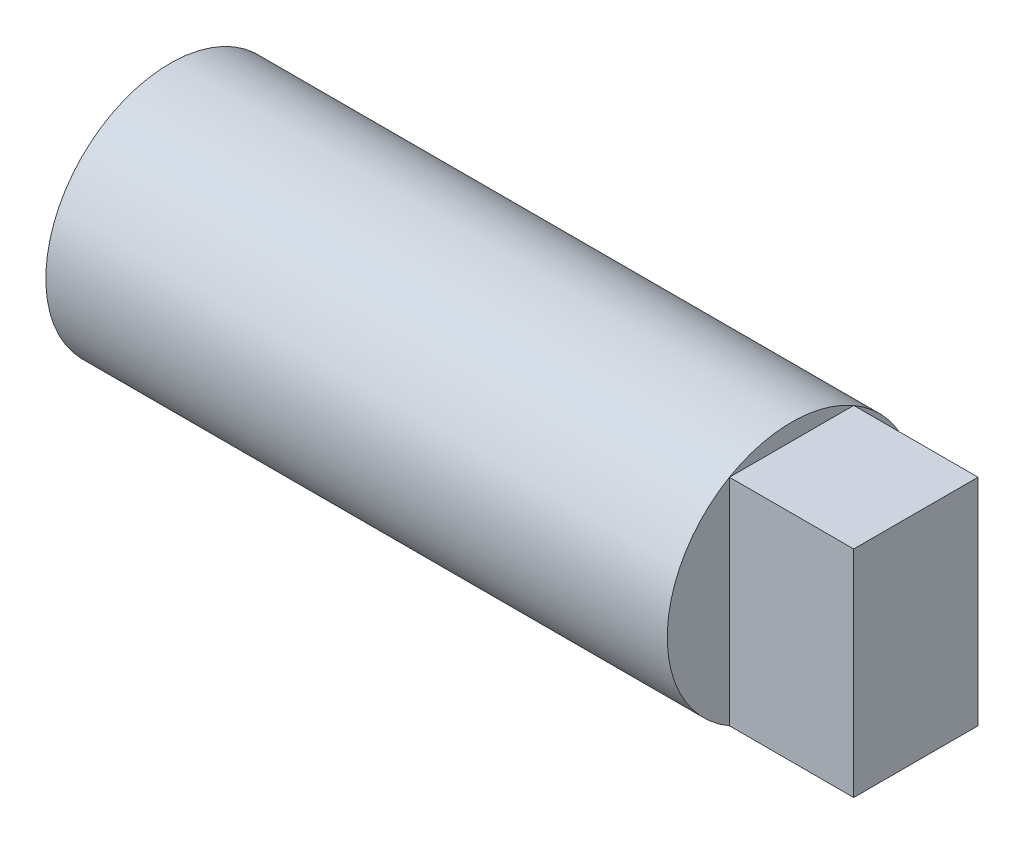
from build123d import *

# Parameters (mm, degrees)
SKETCH_1_R          = 30
EXTRUDE_1_DEPTH     = 10
CUT_EXTRUDE_START   = -10
SKETCH_2_R          = 30
SKETCH_2_R_2        = 10
CUT_EXTRUDE_1_DEPTH = 10
SKETCH_4_R          = 10
EXTRUDE_2_DEPTH     = 40
SKETCH_5_W          = 10
SKETCH_5_H          = 17.320508076
EXTRUDE_3_DEPTH     = 10


with BuildPart() as part:
    # 草图1 → 凸台-拉伸1 (new body)
    with BuildSketch(Plane(origin=(0, 0, 0), x_dir=(0, 0, -1), z_dir=(1, 0, 0))):
        Circle(SKETCH_1_R)
    extrude(amount=EXTRUDE_1_DEPTH)

    # 草图2 → 切除-拉伸1 (cut)
    with BuildSketch(Plane(origin=(10, 0, 0), x_dir=(0, 0, -1), z_dir=(1, 0, 0)).offset(CUT_EXTRUDE_START)):
        Circle(SKETCH_2_R)
        Circle(SKETCH_2_R_2, mode=Mode.SUBTRACT)
    extrude(amount=CUT_EXTRUDE_1_DEPTH, mode=Mode.SUBTRACT)

    # 草图4 → 凸台-拉伸2 (add)
    with BuildSketch(Plane(origin=(10, 0, 0), x_dir=(0, 0, -1), z_dir=(1, 0, 0))):
        Circle(SKETCH_4_R)
    extrude(amount=EXTRUDE_2_DEPTH)

    # 草图5 → 凸台-拉伸3 (add)
    with BuildSketch(Plane(origin=(50, 0, 0), x_dir=(0, 0, -1), z_dir=(1, 0, 0))):
        Rectangle(SKETCH_5_W, SKETCH_5_H)
    extrude(amount=EXTRUDE_3_DEPTH)


solid = part.part
